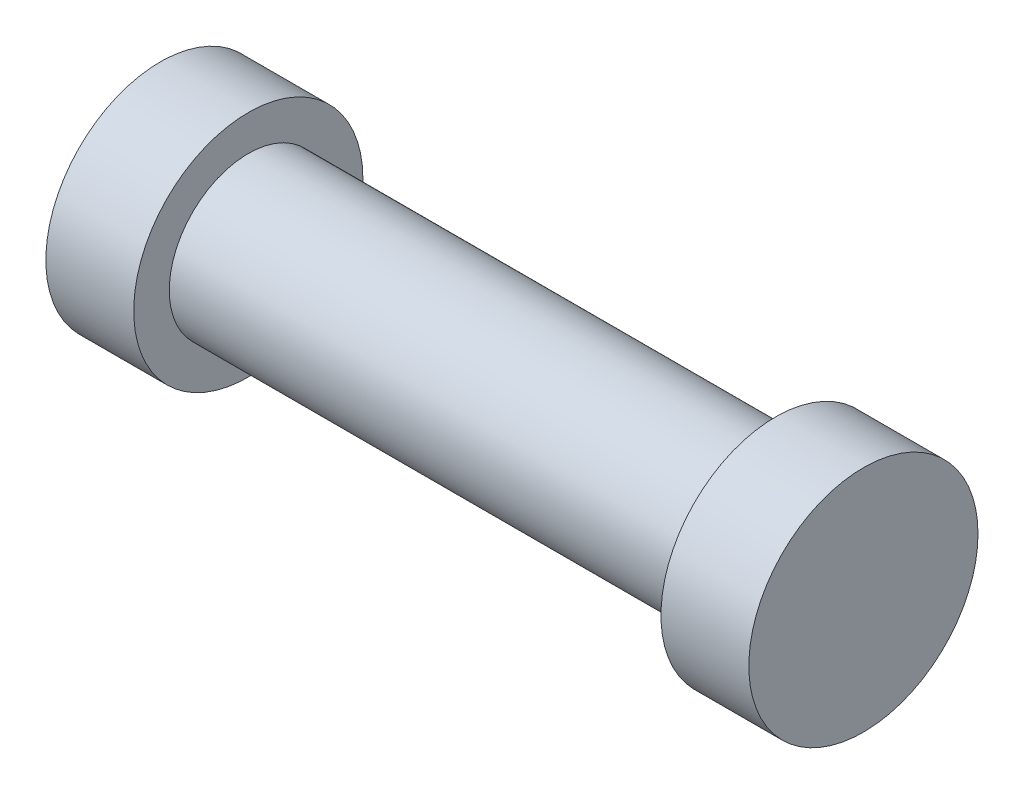
from build123d import *

# Parameters (mm, degrees)
SKETCH1_R           = 0.9
BOSS_EXTRUDE1_DEPTH = 3
SKETCH2_R           = 1.304010521
BOSS_EXTRUDE2_DEPTH = 1


with BuildPart() as part:
    # Sketch1 → Boss-Extrude1 (new, symmetric)
    with BuildSketch(Plane(origin=(0, 0, 0), x_dir=(0, 0, -1), z_dir=(1, 0, 0))):
        Circle(SKETCH1_R)
    extrude(amount=BOSS_EXTRUDE1_DEPTH, both=True)

    # Sketch2 → Boss-Extrude2 (add)
    with BuildSketch(Plane(origin=(3, 0, 0), x_dir=(0, 0, -1), z_dir=(1, 0, 0))):
        Circle(SKETCH2_R)
    boss_extrude2 = extrude(amount=BOSS_EXTRUDE2_DEPTH)

    # Mirror1: Boss-Extrude2 across plane
    add(boss_extrude2.mirror(Plane(origin=(0, 0, 0), x_dir=(0, 0, 1), z_dir=(1, 0, 0))))


solid = part.part
